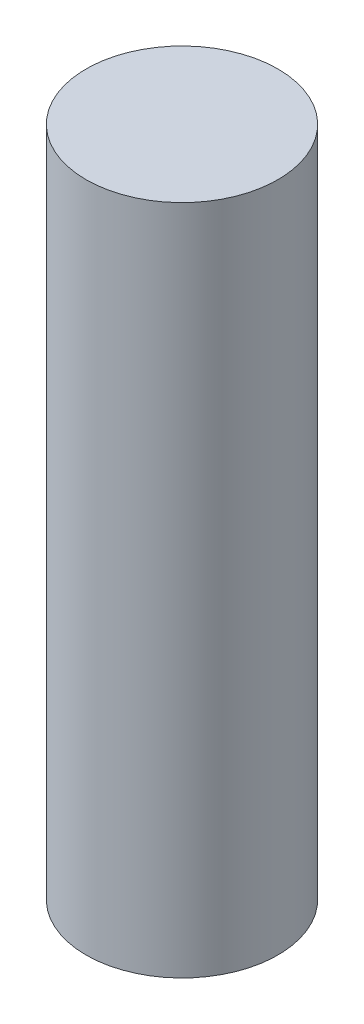
from build123d import *

# Parameters (mm, degrees)
SKETCH1_R           = 5
BOSS_EXTRUDE1_DEPTH = 17.5


with BuildPart() as part:
    # Sketch1 → Boss-Extrude1 (new, symmetric)
    with BuildSketch(Plane(origin=(0, 0, 0), x_dir=(1, 0, 0), z_dir=(0, 1, 0))):
        with Locations(Location((0, 0, 0), (0, 0, 270))):
            Circle(SKETCH1_R)
    extrude(amount=BOSS_EXTRUDE1_DEPTH, both=True)


solid = part.part
